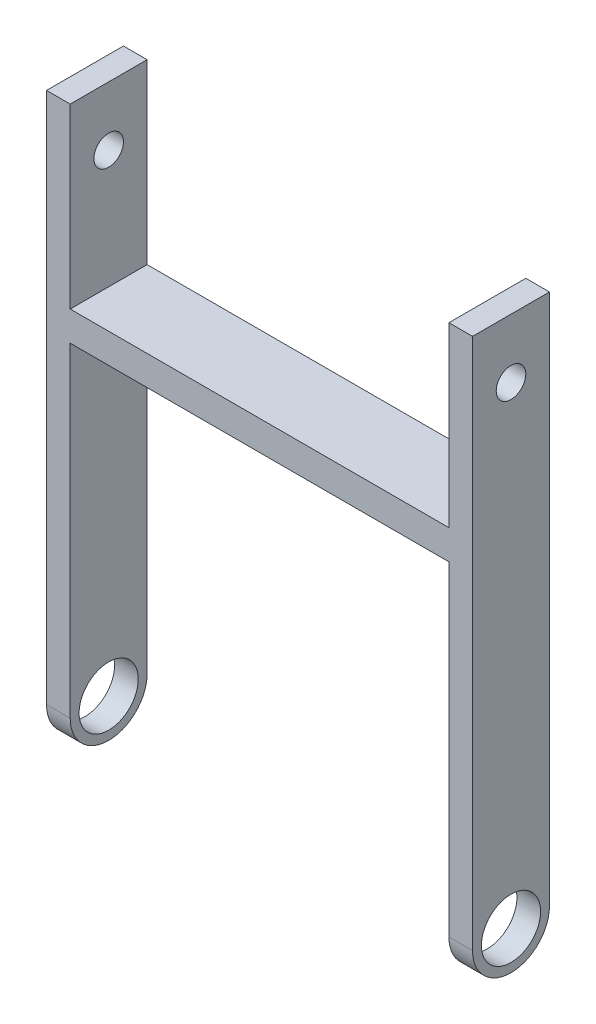
from build123d import *

# Parameters (mm, degrees)
BOSS_EXTRU_1_DEPTH      = 13
ESQUISSE2_R             = 5
ENL_V_MAT_EXTRU_1_DEPTH = 124.907223357
ESQUISSE3_R             = 2.5
ENL_V_MAT_EXTRU_2_DEPTH = 124.907223357
ENL_V_MAT_EXTRU_4_DEPTH = 124.907223357


with BuildPart() as part:
    # Esquisse1 → Boss.-Extru.1 (new body)
    with BuildSketch(Plane.XY):
        Polygon((0, 0), (0, 100), (4, 100), (4, 70), (68, 70), (68, 100), (72, 100), (72, 0), (68, 0), (68, 65), (4, 65), (4, 0), align=None)
    extrude(amount=BOSS_EXTRU_1_DEPTH)

    # Esquisse2 → Enlèv. mat.-Extru.1 (cut, through all)
    with BuildSketch(Plane(origin=(72, 0, 0), x_dir=(0, 0, -1), z_dir=(1, 0, 0))):
        with Locations(Location((-6.5, 10.1, 0), (0, 0, 90))):
            Circle(ESQUISSE2_R)
    extrude(amount=-ENL_V_MAT_EXTRU_1_DEPTH, mode=Mode.SUBTRACT)

    # Esquisse3 → Enlèv. mat.-Extru.2 (cut, through all)
    with BuildSketch(Plane.ZY):
        with Locations((6.5, 90)):
            Circle(ESQUISSE3_R)
    extrude(amount=-ENL_V_MAT_EXTRU_2_DEPTH, mode=Mode.SUBTRACT)

    # Esquisse5 → Enlèv. mat.-Extru.4 (cut, through all)
    with BuildSketch(Plane.ZY):
        with BuildLine():
            Line((0, 10.1), (0, -2.98091379))
            Line((0, -2.98091379), (15.001453012, -2.98091379))
            Line((15.001453012, -2.98091379), (15.001453012, 10.1))
            Line((15.001453012, 10.1), (13, 10.1))
            ThreePointArc((13, 10.1), (6.5, 3.6), (0, 10.1))
        make_face()
    extrude(amount=-ENL_V_MAT_EXTRU_4_DEPTH, mode=Mode.SUBTRACT)


solid = part.part
